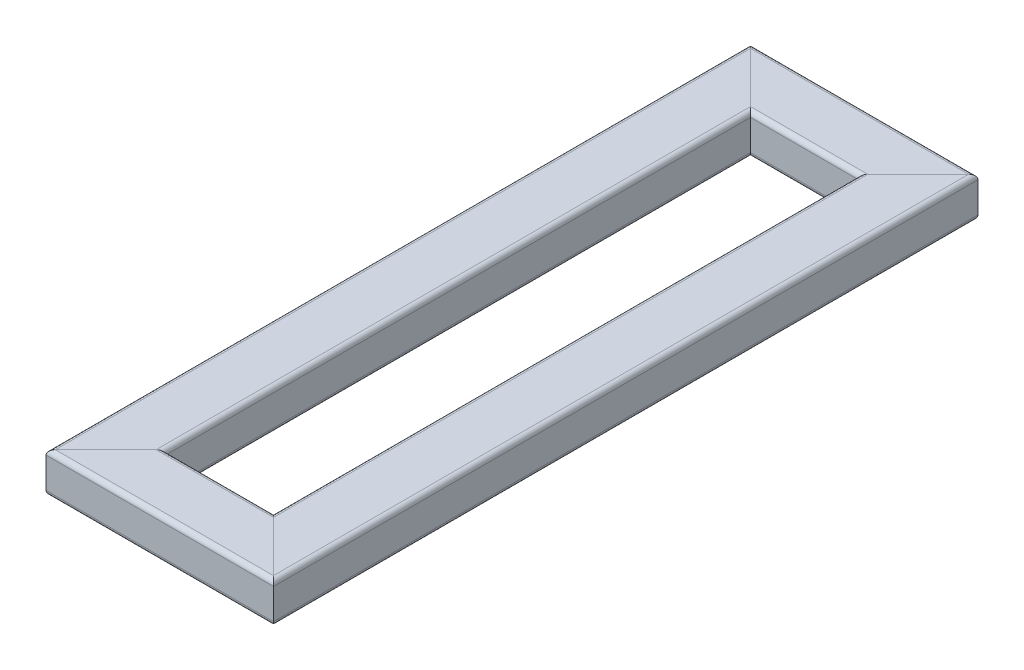
from build123d import *

# Parameters (mm, degrees)
TUBO_RECTANGULAR_3_X_2_X_0_25_1_DEPTH      = 990.581002397
TUBO_RECTANGULAR_3_X_2_X_0_25_1_DEPTH_BACK = 92.581002397
TUBO_RECTANGULAR_3_X_2_X_0_25_1_2_DEPTH    = 475.162004794
TUBO_RECTANGULAR_3_X_2_X_0_25_1_3_DEPTH    = 1083.162004794
TUBO_RECTANGULAR_3_X_2_X_0_25_1_4_DEPTH    = 475.162004794


with BuildPart() as part:
    # Sketch1 → Tubo rectangular 3 X 2 X 0.25(1) (new, two sides: drawn at the far end of the back side and taken through both)
    with BuildSketch(Plane(origin=(-106.9, 25.4, -449), x_dir=(1, 0, 0), z_dir=(0, 0, 1)).offset(-TUBO_RECTANGULAR_3_X_2_X_0_25_1_DEPTH_BACK)):
        with BuildLine():
            Line((-32.1, -25.4), (32.1, -25.4))
            ThreePointArc((32.1, -25.4), (36.342640687, -23.642640687), (38.1, -19.4))
            Line((38.1, -19.4), (38.1, 19.4))
            ThreePointArc((38.1, 19.4), (36.342640687, 23.642640687), (32.1, 25.4))
            Line((32.1, 25.4), (-32.1, 25.4))
            ThreePointArc((-32.1, 25.4), (-36.342640687, 23.642640687), (-38.1, 19.4))
            Line((-38.1, 19.4), (-38.1, -19.4))
            ThreePointArc((-38.1, -19.4), (-36.342640687, -23.642640687), (-32.1, -25.4))
        make_face()
        with BuildLine():
            Line((-32.1, -22.4), (32.1, -22.4))
            ThreePointArc((32.1, -22.4), (34.221320344, -21.521320344), (35.1, -19.4))
            Line((35.1, -19.4), (35.1, 19.4))
            ThreePointArc((35.1, 19.4), (34.221320344, 21.521320344), (32.1, 22.4))
            Line((32.1, 22.4), (-32.1, 22.4))
            ThreePointArc((-32.1, 22.4), (-34.221320344, 21.521320344), (-35.1, 19.4))
            Line((-35.1, 19.4), (-35.1, -19.4))
            ThreePointArc((-35.1, -19.4), (-34.221320344, -21.521320344), (-32.1, -22.4))
        make_face(mode=Mode.SUBTRACT)
    extrude(amount=TUBO_RECTANGULAR_3_X_2_X_0_25_1_DEPTH + TUBO_RECTANGULAR_3_X_2_X_0_25_1_DEPTH_BACK)

    # Tubo rectangular 3 X 2 X 0.25(1) mitre 1
    split(bisect_by=Plane(origin=(-145, 0, -449), x_dir=(0, -1, 0), z_dir=(-0.707106781, 0, 0.707106781)), keep=Keep.TOP)

    # Tubo rectangular 3 X 2 X 0.25(1) mitre 2
    split(bisect_by=Plane(origin=(-145, 0, 449), x_dir=(0, -1, 0), z_dir=(-0.707106781, 0, -0.707106781)), keep=Keep.TOP)


with BuildPart() as body_2:
    # Sketch1 on segment 2 (carried to segment 2) → Tubo rectangular 3 X 2 X 0.25_1 2 (new body)
    with BuildSketch(Plane(origin=(-237.581002397, 25.4, 410.9), x_dir=(0, 0, -1), z_dir=(1, 0, 0))):
        with BuildLine():
            Line((-32.1, -25.4), (32.1, -25.4))
            ThreePointArc((32.1, -25.4), (36.342640687, -23.642640687), (38.1, -19.4))
            Line((38.1, -19.4), (38.1, 19.4))
            ThreePointArc((38.1, 19.4), (36.342640687, 23.642640687), (32.1, 25.4))
            Line((32.1, 25.4), (-32.1, 25.4))
            ThreePointArc((-32.1, 25.4), (-36.342640687, 23.642640687), (-38.1, 19.4))
            Line((-38.1, 19.4), (-38.1, -19.4))
            ThreePointArc((-38.1, -19.4), (-36.342640687, -23.642640687), (-32.1, -25.4))
        make_face()
        with BuildLine():
            Line((-32.1, -22.4), (32.1, -22.4))
            ThreePointArc((32.1, -22.4), (34.221320344, -21.521320344), (35.1, -19.4))
            Line((35.1, -19.4), (35.1, 19.4))
            ThreePointArc((35.1, 19.4), (34.221320344, 21.521320344), (32.1, 22.4))
            Line((32.1, 22.4), (-32.1, 22.4))
            ThreePointArc((-32.1, 22.4), (-34.221320344, 21.521320344), (-35.1, 19.4))
            Line((-35.1, 19.4), (-35.1, -19.4))
            ThreePointArc((-35.1, -19.4), (-34.221320344, -21.521320344), (-32.1, -22.4))
        make_face(mode=Mode.SUBTRACT)
    extrude(amount=TUBO_RECTANGULAR_3_X_2_X_0_25_1_2_DEPTH)

    # Tubo rectangular 3 X 2 X 0.25_1 2 mitre
    split(bisect_by=Plane(origin=(-145, 0, 449), x_dir=(0, 1, 0), z_dir=(0.707106781, 0, 0.707106781)), keep=Keep.TOP)

    # Tubo rectangular 3 X 2 X 0.25_1 2 mi 2
    split(bisect_by=Plane(origin=(145, 0, 449), x_dir=(0, -1, 0), z_dir=(-0.707106781, 0, 0.707106781)), keep=Keep.TOP)


with BuildPart() as body_3:
    # Sketch1 on segment 3 (carried to segment 3) → Tubo rectangular 3 X 2 X 0.25_1 3 (new body)
    with BuildSketch(Plane(origin=(106.9, 25.4, 541.581002397), x_dir=(-1, 0, 0), z_dir=(0, 0, -1))):
        with BuildLine():
            Line((-32.1, -25.4), (32.1, -25.4))
            ThreePointArc((32.1, -25.4), (36.342640687, -23.642640687), (38.1, -19.4))
            Line((38.1, -19.4), (38.1, 19.4))
            ThreePointArc((38.1, 19.4), (36.342640687, 23.642640687), (32.1, 25.4))
            Line((32.1, 25.4), (-32.1, 25.4))
            ThreePointArc((-32.1, 25.4), (-36.342640687, 23.642640687), (-38.1, 19.4))
            Line((-38.1, 19.4), (-38.1, -19.4))
            ThreePointArc((-38.1, -19.4), (-36.342640687, -23.642640687), (-32.1, -25.4))
        make_face()
        with BuildLine():
            Line((-32.1, -22.4), (32.1, -22.4))
            ThreePointArc((32.1, -22.4), (34.221320344, -21.521320344), (35.1, -19.4))
            Line((35.1, -19.4), (35.1, 19.4))
            ThreePointArc((35.1, 19.4), (34.221320344, 21.521320344), (32.1, 22.4))
            Line((32.1, 22.4), (-32.1, 22.4))
            ThreePointArc((-32.1, 22.4), (-34.221320344, 21.521320344), (-35.1, 19.4))
            Line((-35.1, 19.4), (-35.1, -19.4))
            ThreePointArc((-35.1, -19.4), (-34.221320344, -21.521320344), (-32.1, -22.4))
        make_face(mode=Mode.SUBTRACT)
    extrude(amount=TUBO_RECTANGULAR_3_X_2_X_0_25_1_3_DEPTH)

    # Tubo rectangular 3 X 2 X 0.25_1 3 mitre
    split(bisect_by=Plane(origin=(145, 0, -449), x_dir=(0, 1, 0), z_dir=(0.707106781, 0, 0.707106781)), keep=Keep.TOP)

    # Tubo rectangular 3 X 2 X 0.25_1 3 mi 2
    split(bisect_by=Plane(origin=(145, 0, 449), x_dir=(0, 1, 0), z_dir=(0.707106781, 0, -0.707106781)), keep=Keep.TOP)


with BuildPart() as body_4:
    # Sketch1 on segment 4 (carried to segment 4) → Tubo rectangular 3 X 2 X 0.25_1 4 (new body)
    with BuildSketch(Plane(origin=(237.581002397, 25.4, -410.9), x_dir=(0, 0, 1), z_dir=(-1, 0, 0))):
        with BuildLine():
            Line((-32.1, -25.4), (32.1, -25.4))
            ThreePointArc((32.1, -25.4), (36.342640687, -23.642640687), (38.1, -19.4))
            Line((38.1, -19.4), (38.1, 19.4))
            ThreePointArc((38.1, 19.4), (36.342640687, 23.642640687), (32.1, 25.4))
            Line((32.1, 25.4), (-32.1, 25.4))
            ThreePointArc((-32.1, 25.4), (-36.342640687, 23.642640687), (-38.1, 19.4))
            Line((-38.1, 19.4), (-38.1, -19.4))
            ThreePointArc((-38.1, -19.4), (-36.342640687, -23.642640687), (-32.1, -25.4))
        make_face()
        with BuildLine():
            Line((-32.1, -22.4), (32.1, -22.4))
            ThreePointArc((32.1, -22.4), (34.221320344, -21.521320344), (35.1, -19.4))
            Line((35.1, -19.4), (35.1, 19.4))
            ThreePointArc((35.1, 19.4), (34.221320344, 21.521320344), (32.1, 22.4))
            Line((32.1, 22.4), (-32.1, 22.4))
            ThreePointArc((-32.1, 22.4), (-34.221320344, 21.521320344), (-35.1, 19.4))
            Line((-35.1, 19.4), (-35.1, -19.4))
            ThreePointArc((-35.1, -19.4), (-34.221320344, -21.521320344), (-32.1, -22.4))
        make_face(mode=Mode.SUBTRACT)
    extrude(amount=TUBO_RECTANGULAR_3_X_2_X_0_25_1_4_DEPTH)

    # Tubo rectangular 3 X 2 X 0.25_1 4 mitre
    split(bisect_by=Plane(origin=(-145, 0, -449), x_dir=(0, 1, 0), z_dir=(0.707106781, 0, -0.707106781)), keep=Keep.TOP)

    # Tubo rectangular 3 X 2 X 0.25_1 4 mi 2
    split(bisect_by=Plane(origin=(145, 0, -449), x_dir=(0, -1, 0), z_dir=(-0.707106781, 0, -0.707106781)), keep=Keep.TOP)


solid = Compound([part.part, body_2.part, body_3.part, body_4.part])
